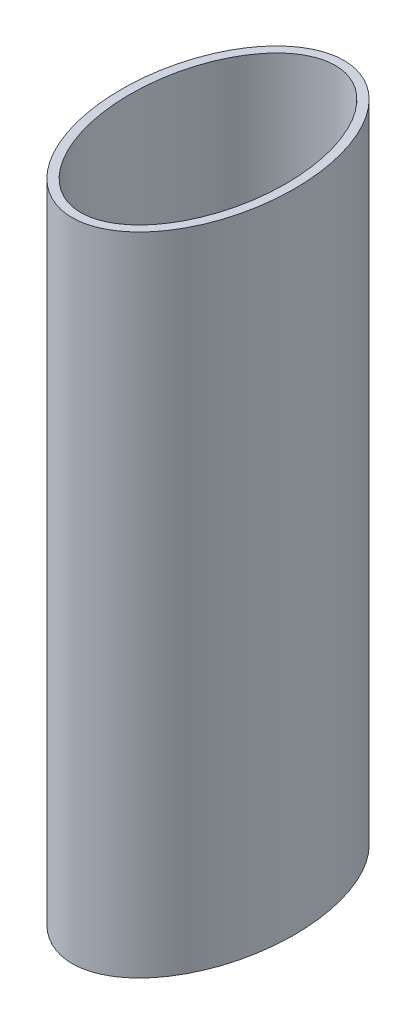
from build123d import *

# Parameters (mm, degrees)
SKETCH1_RX          = 40.005
SKETCH1_RY          = 25.4
BOSS_EXTRUDE1_DEPTH = 190
SHELL1_T            = -2.54


with BuildPart() as part:
    # Sketch1 → Boss-Extrude1 (new body)
    with BuildSketch(Plane(origin=(0, 0, 0), x_dir=(1, 0, 0), z_dir=(0, 1, 0))):
        with Locations(Location((0, 0), (0, 0, 90))):
            Ellipse(SKETCH1_RX, SKETCH1_RY)
    extrude(amount=BOSS_EXTRUDE1_DEPTH)

    # Shell1
    shell1_openings = [part.faces().sort_by_distance(p)[0] for p in [
        (0, 190, 0),
    ]]
    offset(amount=SHELL1_T, openings=shell1_openings, kind=Kind.INTERSECTION)


solid = part.part
